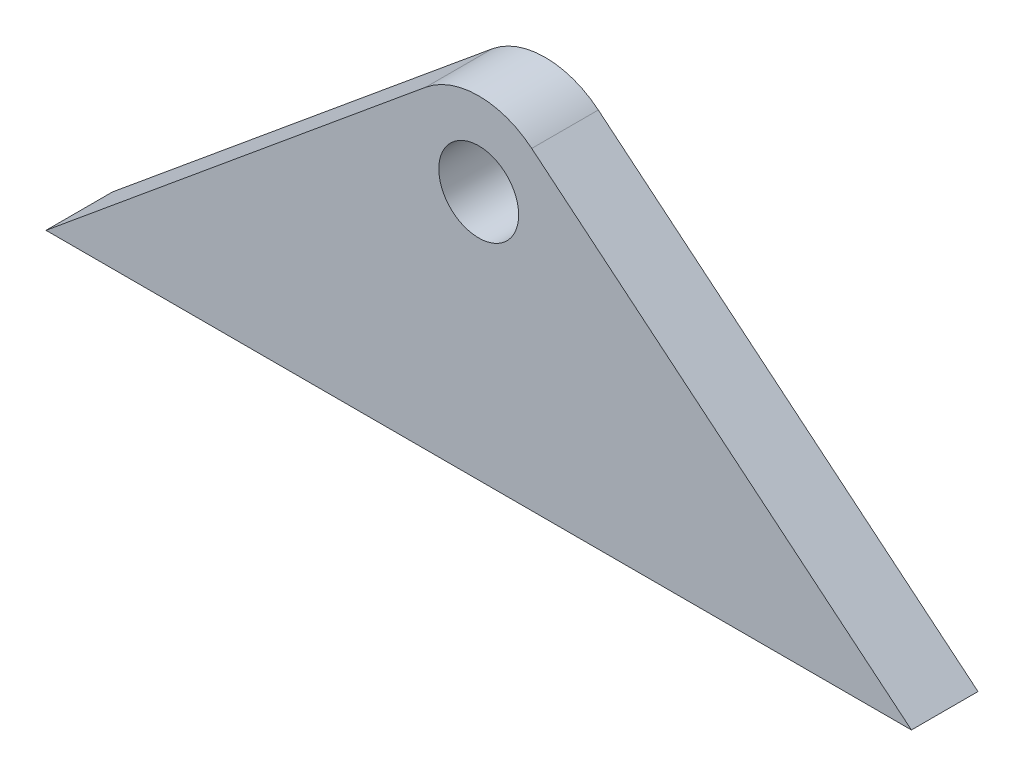
from build123d import *

# Parameters (mm, degrees)
SKETCH2_R           = 12
BOSS_EXTRUDE1_DEPTH = 10


with BuildPart() as part:
    # Sketch2 → Boss-Extrude1 (new, symmetric)
    with BuildSketch(Plane.XY):
        with BuildLine():
            Line((130, 0), (-130, 0))
            Line((-130, 0), (-15.92562313, 94.271080092))
            ThreePointArc((-15.92562313, 94.271080092), (0, 100), (15.92562313, 94.271080092))
            Line((15.92562313, 94.271080092), (130, 0))
        make_face()
        with Locations((0, 75)):
            Circle(SKETCH2_R, mode=Mode.SUBTRACT)
    extrude(amount=BOSS_EXTRUDE1_DEPTH, both=True)


solid = part.part
